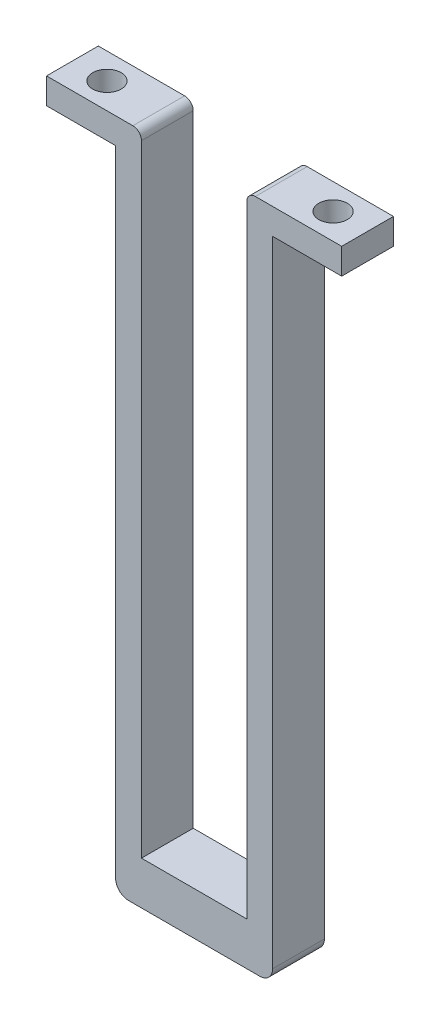
from build123d import *

# Parameters (mm, degrees)
BOSS_EXTRUDE5_DEPTH = 6
SKETCH7_R           = 1.65
CUT_EXTRUDE2_DEPTH  = 3
FILLET1_R           = 1
FILLET2_R           = 1.5


with BuildPart() as part:
    # Sketch6 → Boss-Extrude5 (new body)
    with BuildSketch(Plane.XY):
        Polygon((-6.1, 0), (6.1, 0), (6.1, 73), (17.1, 73), (17.1, 70), (9.1, 70), (9.1, -5), (-9.1, -5), (-9.1, 70), (-17.1, 70), (-17.1, 73), (-6.1, 73), align=None)
    extrude(amount=BOSS_EXTRUDE5_DEPTH)

    # Sketch7 → Cut-Extrude2 (cut)
    with BuildSketch(Plane.XZ.offset(-70)):
        with Locations((-13.1, 3)):
            Circle(SKETCH7_R)
        with Locations((13.1, 3)):
            Circle(SKETCH7_R)
    extrude(amount=-CUT_EXTRUDE2_DEPTH, mode=Mode.SUBTRACT)

    # Fillet1
    fillet1_edges = [part.edges().sort_by_distance(p)[0] for p in [
        (6.1, 73, 3),
        (-6.1, 73, 3),
    ]]
    fillet(fillet1_edges, radius=FILLET1_R)

    # Fillet2
    fillet2_edges = [part.edges().sort_by_distance(p)[0] for p in [
        (9.1, -5, 3),
        (-9.1, -5, 3),
    ]]
    fillet(fillet2_edges, radius=FILLET2_R)


solid = part.part
